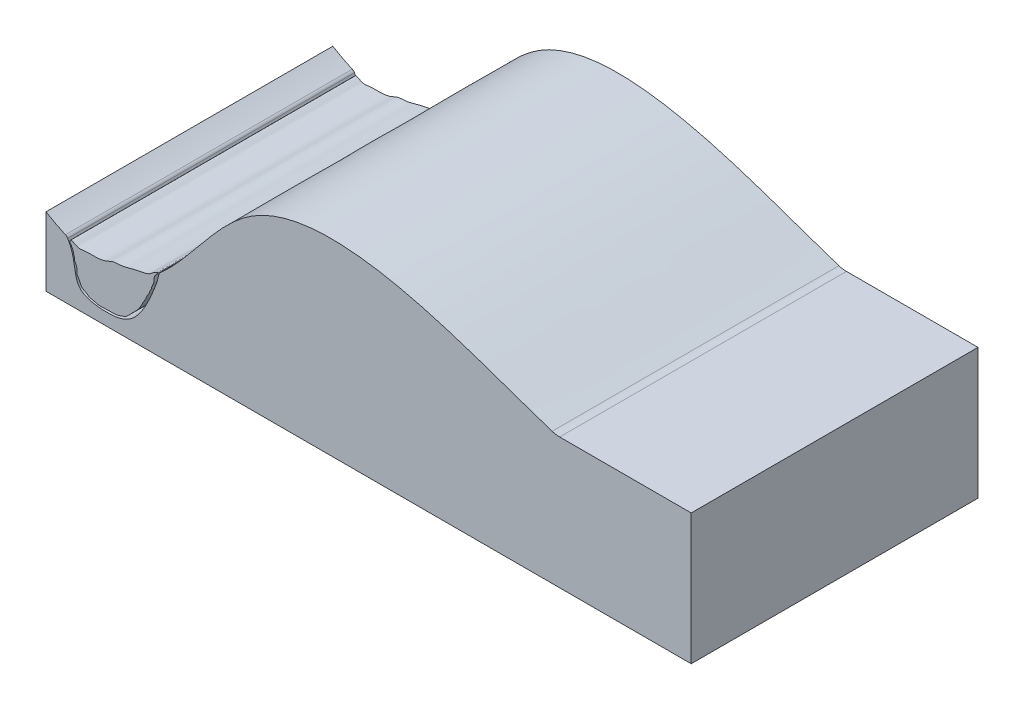
from build123d import *

# Parameters (mm, degrees)
SKETCH1_W            = 390144
SKETCH1_H            = 219456
BOSS_EXTRUDE1_DEPTH  = 163624.768
CUT_EXTRUDE2_DEPTH   = 271472.66
CUT_EXTRUDE3_DEPTH   = 346295.98
BOSS_EXTRUDE10_DEPTH = 217957.146
FILLET2_R            = 3810
SKETCH9_W            = 219456
SKETCH9_H            = 99964.364170083
BOSS_EXTRUDE12_DEPTH = 103579.676
FILLET4_R            = 19050


with BuildPart() as part:
    # Sketch1 → Boss-Extrude1 (new body)
    with BuildSketch(Plane(origin=(0, 0, 0), x_dir=(1, 0, 0), z_dir=(0, 1, 0))):
        with Locations((195072, 109728)):
            Rectangle(SKETCH1_W, SKETCH1_H)
    extrude(amount=BOSS_EXTRUDE1_DEPTH)

    # Sketch3 → Cut-Extrude2 (cut)
    with BuildSketch(Plane.XY):
        with BuildLine():
            Line((0, 163624.768), (0, 52667.881428276))
            add(Edge.make_bspline(
                [(0, 52667.881428276), (83559.657234125, 2393.552459645), (133616.286871643, 210787.472707253), (330012.548128856, 118598.212832559), (390144, 99964.364170083)],
                knots=[0, 0, 0, 0, 0.441082237, 1, 1, 1, 1], degree=3))
            Line((390144, 99964.364170083), (390144, 163624.768))
            Line((390144, 163624.768), (0, 163624.768))
        make_face()
    extrude(amount=-CUT_EXTRUDE2_DEPTH, mode=Mode.SUBTRACT)

    # Sketch5 → Cut-Extrude3 (cut)
    with BuildSketch(Plane.XY):
        with BuildLine():
            add(Edge.make_bspline(
                [(15943.938929574, 44438.801470526), (24000.97956224, 32165.070747339), (17610.944775244, 11877.30092773), (53463.096145325, 7585.183503069), (74840.756530718, 15824.668226501), (91313.903548003, 64441.148914276), (81506.827408491, 54111.260298517), (76367.106638933, 50845.028986764), (68202.503287718, 44982.043979714), (56865.268182729, 41044.130560663), (45351.243870284, 39680.873085513), (35439.52730638, 39718.468582586), (25773.191789485, 42444.451962246), (20914.115902546, 42940.035962595), (14431.749573097, 46625.099297439), (15512.448178871, 45096.114934007), (15943.938929574, 44438.801470526)],
                knots=[0, 0, 0, 0, 0.165559326, 0.282229247, 0.43850359, 0.608520178, 0.616398336, 0.649041552, 0.704919284, 0.771327806, 0.833559197, 0.884172896, 0.927201117, 0.97940914, 0.991133554, 1, 1, 1, 1], degree=3))
        make_face()
    extrude(amount=-CUT_EXTRUDE3_DEPTH, mode=Mode.SUBTRACT)

    # Fillet2
    fillet2_edges = [part.edges().sort_by_distance(p)[0] for p in [
        (86418.162687109, 55180.787024423, -109728.0000003),
        (15943.938929574, 44438.801470526, -109728),
    ]]
    fillet(fillet2_edges, radius=FILLET2_R)

    # Sketch9 → Boss-Extrude12 (add)
    with BuildSketch(Plane(origin=(390144, 0, 0), x_dir=(0, 0, -1), z_dir=(1, 0, 0))):
        with Locations((109728, 49982.182085042)):
            Rectangle(SKETCH9_W, SKETCH9_H)
    extrude(amount=BOSS_EXTRUDE12_DEPTH)

    # Fillet4
    fillet4_edges = [part.edges().sort_by_distance(p)[0] for p in [
        (390144, 99964.364170083, -109728),
    ]]
    fillet(fillet4_edges, radius=FILLET4_R)


with BuildPart() as body_2:
    # Sketch7 → Boss-Extrude10 (new body)
    with BuildSketch(Plane.XY):
        with BuildLine():
            add(Edge.make_bspline(
                [(18453.120407378, 42903.994387305), (19279.041164545, 44438.359478442), (23962.754245909, 40353.966510886), (30183.914656624, 41954.918234595), (37537.517540702, 41407.495500827), (45520.141502476, 42410.20608213), (51483.200610616, 45890.303096084), (58555.240721572, 45493.879061531), (65378.152851453, 47875.252739367), (72346.051931403, 49244.943962097), (78836.832862775, 50436.598007467), (81449.834528039, 53125.890760716), (86286.383974804, 55943.792197896), (84079.828947511, 52690.56129342), (82687.650042025, 51130.442240318), (82652.20913462, 48852.613221119), (82536.559461446, 46912.362342799), (81786.181594424, 45027.430478035), (80694.097635989, 43387.664804339), (80640.114672071, 41164.427762298), (79194.093773283, 39860.405658614), (79031.075028234, 37598.474648959), (76995.711930968, 35793.465930894), (76552.993446523, 32965.459192935), (74618.278475675, 30683.643097539), (73690.963861706, 28196.472307104), (72158.783858075, 25747.567848519), (70755.143868881, 23302.313641523), (68431.791849782, 21204.450001992), (66260.075599825, 18679.895994982), (63729.264781367, 16312.874457665), (61435.829477051, 13764.899477549), (57894.769191582, 12644.002904495), (54454.264811842, 11179.532512239), (50672.184607871, 11282.329542294), (47077.013841889, 11118.537392031), (43379.518356676, 11131.82597057), (39786.728131325, 10843.944114795), (36520.911796858, 12108.412372349), (33326.848672141, 12299.978608234), (30638.827239635, 14774.594771298), (27304.713749387, 15781.238439444), (26082.907205575, 19021.382801849), (25051.158302423, 21270.87846555), (23527.988488687, 23006.205473198), (23757.790549199, 24769.522480588), (23527.089533642, 26476.901833534), (23660.244299618, 27985.543393399), (22878.459351482, 28895.86000685), (22873.704039919, 29744.981554663), (22343.211723379, 30428.730568969), (21873.207815252, 31131.155966318), (21931.726002228, 31903.538275755), (22007.164370441, 32713.113522625), (21621.470932193, 33635.479839131), (21460.463807293, 34502.171061317), (21115.263346129, 35254.834259194), (21089.960375994, 36107.525072825), (20759.141933772, 37218.368267333), (20297.875964607, 38469.12161049), (19537.737400256, 39469.763624097), (19282.214559018, 40516.71582602), (18070.786584019, 41127.045518015), (18203.114802691, 42439.543204681), (18453.120407378, 42903.994387305)],
                knots=[0, 0, 0, 0, 0.032228133, 0.056848986, 0.110768164, 0.150328149, 0.188550866, 0.220725386, 0.264216766, 0.305584698, 0.341893531, 0.362147879, 0.381063451, 0.39333657, 0.40506114, 0.419120805, 0.427995913, 0.43740222, 0.452165672, 0.459727907, 0.472635221, 0.481313626, 0.495357933, 0.514511589, 0.52623616, 0.543894958, 0.55783903, 0.573944724, 0.590043718, 0.609107026, 0.628815975, 0.647565392, 0.664217867, 0.689048188, 0.708581162, 0.725775581, 0.748542995, 0.769917086, 0.783892077, 0.805976265, 0.820020572, 0.842967372, 0.858761882, 0.873929096, 0.88476404, 0.894530526, 0.90151416, 0.913734415, 0.917479692, 0.920305405, 0.927164321, 0.931319332, 0.933642054, 0.939681131, 0.944531117, 0.949827738, 0.954234793, 0.95798007, 0.963726166, 0.973302994, 0.979756651, 0.984331883, 0.990244568, 1, 1, 1, 1], degree=3))
        make_face()
    extrude(amount=-BOSS_EXTRUDE10_DEPTH)


solid = Compound([part.part, body_2.part])
